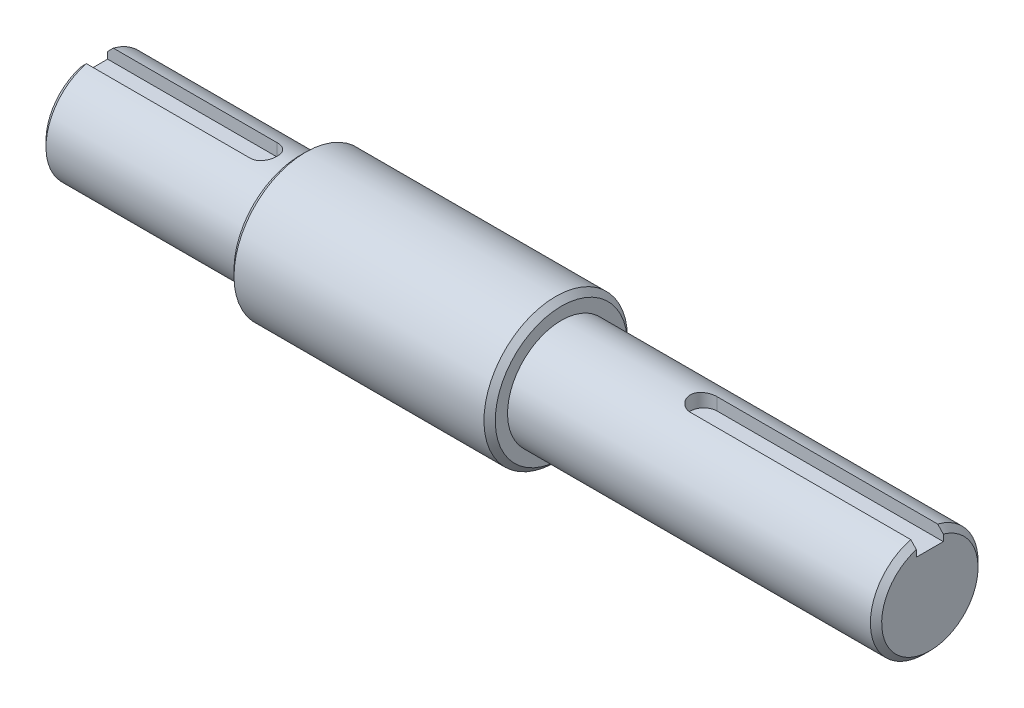
from build123d import *

# Parameters (mm, degrees)
CORTAR_EXTRUIR1_DEPTH = 2.5
CHAFL_N1_SIZE         = 1


with BuildPart() as part:
    # Croquis1 → Revolución1 (revolve)
    with BuildSketch(Plane.XY):
        Polygon((-23.114362081, 0), (23.114362081, 0), (23.114362081, -3.175), (88.311435021, -3.175), (88.311435021, -12.7), (-59.557840342, -12.7), (-59.557840342, -3.175), (-23.114362081, -3.175), align=None)
    revolve(axis=Axis((88.311435021, -12.7, 0), (-1, 0, 0)))

    # Croquis2 → Cortar-Extruir1 (cut)
    with BuildSketch(Plane(origin=(0, -3.175, 0), x_dir=(1, 0, 0), z_dir=(0, 1, 0))):
        with BuildLine():
            Line((48.311435021, 2.38125), (88.311435021, 2.38125))
            ThreePointArc((88.311435021, 2.38125), (90.692685021, 0), (88.311435021, -2.38125))
            Line((88.311435021, -2.38125), (48.311435021, -2.38125))
            ThreePointArc((48.311435021, -2.38125), (45.930185021, 0), (48.311435021, 2.38125))
        make_face()
        with BuildLine():
            Line((-59.557840342, 2.38125), (-29.557840342, 2.38125))
            ThreePointArc((-29.557840342, 2.38125), (-27.176590342, 0), (-29.557840342, -2.38125))
            Line((-29.557840342, -2.38125), (-59.557840342, -2.38125))
            ThreePointArc((-59.557840342, -2.38125), (-61.939090342, 0), (-59.557840342, 2.38125))
        make_face()
    extrude(amount=-CORTAR_EXTRUIR1_DEPTH, mode=Mode.SUBTRACT)

    # Chaflán1
    chafl_n1_edges = [part.edges().sort_by_distance(p)[0] for p in [
        (88.311435021, -22.225, 0),
        (-59.557840342, -22.225, 0),
        (23.114362081, -25.4, 0),
        (-23.114362081, -25.4, 0),
    ]]
    chamfer(chafl_n1_edges, length=CHAFL_N1_SIZE)


solid = part.part
